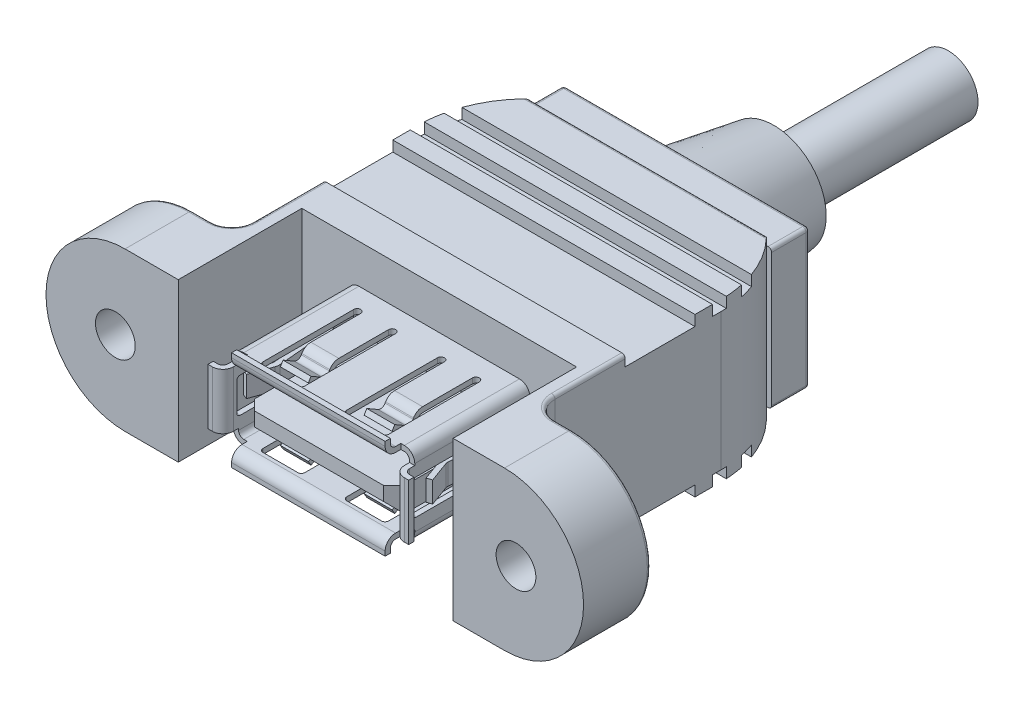
from build123d import *

# Parameters (mm, degrees)
EXTRUDE1_DEPTH     = 5.7531
SKETCH2_W          = 17.907
SKETCH2_H          = 10.16
EXTRUDE2_DEPTH     = 2.7686
EXTRUDE3_DEPTH     = 4.9
EXTRUDE4_DEPTH     = 1.27
SKETCH5_R          = 1.4478
CUT_EXTRUDE1_DEPTH = 4.9
SKETCH9_R          = 2.159
EXTRUDE5_DEPTH     = 12.7
CUT_EXTRUDE2_DEPTH = 0.762
CUT_EXTRUDE3_DEPTH = 0.762
FILLET1_R          = 1.524
FILLET2_R          = 0.254
EXTRUDE6_DEPTH     = 8.382
SKETCH11_W         = 0.381
SKETCH11_H         = 4.064
SKETCH11_W_2       = 11.176
SKETCH11_H_2       = 0.381
EXTRUDE7_DEPTH     = 0.254
EXTRUDE8_DEPTH     = 11.176
EXTRUDE9_DEPTH     = 4.064
CUT_EXTRUDE4_REACH = 44.824
CUT_EXTRUDE5_DEPTH = 13.462
EXTRUDE10_DEPTH    = 2.032
EXTRUDE11_DEPTH    = 2.032
EXTRUDE12_DEPTH    = 1.524
SKETCH21_W         = 10.922
SKETCH21_H         = 1.778
EXTRUDE14_DEPTH    = 8.7376
CHAMFER2_SIZE      = 0.762


with BuildPart() as part:
    # Sketch1 → Extrude1 (new, symmetric)
    with BuildSketch(Plane(origin=(0, 0, 0), x_dir=(1, 0, 0), z_dir=(0, 1, 0))):
        with BuildLine():
            Line((-10.00125, 0), (-10.00125, -8.9916))
            Line((-10.00125, -8.9916), (-10.9982, -8.9916))
            Line((-10.9982, -8.9916), (-10.9982, 9.525))
            ThreePointArc((-10.9982, 9.525), (-10.365731932, 12.629901726), (-8.569119124, 15.24))
            Line((-8.569119124, 15.24), (8.569119124, 15.24))
            ThreePointArc((8.569119124, 15.24), (10.365731932, 12.629901726), (10.9982, 9.525))
            Line((10.9982, 9.525), (10.9982, -8.9916))
            Line((10.9982, -8.9916), (10.00125, -8.9916))
            Line((10.00125, -8.9916), (10.00125, 0))
            Line((10.00125, 0), (-10.00125, 0))
        make_face()
    extrude(amount=EXTRUDE1_DEPTH, both=True)

    # Sketch2 → Extrude2 (add)
    with BuildSketch(Plane(origin=(0, 0, -15.24), x_dir=(-1, 0, 0), z_dir=(0, 0, -1))):
        Rectangle(SKETCH2_W, SKETCH2_H)
    extrude(amount=EXTRUDE2_DEPTH)

    # Sketch3 → Extrude3 (add)
    with BuildSketch(Plane.XY.offset(8.9916)):
        with BuildLine():
            Line((10.00125, 5.7531), (13.74575, 5.7531))
            ThreePointArc((13.74575, 5.7531), (19.49885, 0), (13.74575, -5.7531))
            Line((13.74575, -5.7531), (10.00125, -5.7531))
            Line((10.00125, -5.7531), (10.00125, 5.7531))
        make_face()
        with BuildLine():
            Line((-10.00125, 5.7531), (-13.87575, 5.7531))
            ThreePointArc((-13.87575, 5.7531), (-19.62885, 0), (-13.87575, -5.7531))
            Line((-13.87575, -5.7531), (-10.00125, -5.7531))
            Line((-10.00125, -5.7531), (-10.00125, 5.7531))
        make_face()
    extrude(amount=-EXTRUDE3_DEPTH)

    # Sketch4 → Extrude4 (add, symmetric)
    with BuildSketch(Plane(origin=(0, 0, 0), x_dir=(1, 0, 0), z_dir=(0, 1, 0))):
        Polygon((-10.9982, -1.5516), (-12.7762, -4.0916), (-10.9982, -4.0916), align=None)
        Polygon((10.9982, -1.5516), (12.7762, -4.0916), (10.9982, -4.0916), align=None)
    extrude(amount=EXTRUDE4_DEPTH, both=True)

    # Sketch5 → Cut-Extrude1 (cut)
    with BuildSketch(Plane.XY.offset(8.9916)):
        with Locations((-14.5801, 0)):
            Circle(SKETCH5_R)
        with Locations((14.5801, 0)):
            Circle(SKETCH5_R)
    extrude(amount=-CUT_EXTRUDE1_DEPTH, mode=Mode.SUBTRACT)

    # Sketch6 → Revolve1 (revolve)
    with BuildSketch(Plane(origin=(0, 0, 0), x_dir=(1, 0, 0), z_dir=(0, 1, 0)), mode=Mode.PRIVATE) as revolve1_sk:
        Polygon((0, 18.0086), (4.826, 18.0086), (3.81, 24.3586), (0, 24.3586), align=None)
    revolve(revolve1_sk.sketch.rotate(Axis((0, 0, -27.379986608), (0, 0, 1)), 180), axis=Axis((0, 0, -27.379986608), (0, 0, 1)))

    # Sketch9 → Extrude5 (add)
    with BuildSketch(Plane(origin=(0, 0, -24.3586), x_dir=(-1, 0, 0), z_dir=(0, 0, -1))):
        with Locations(Location((0, 0, 0), (0, 0, 180))):
            Circle(SKETCH9_R)
    extrude(amount=EXTRUDE5_DEPTH)

    # Sketch7 → Cut-Extrude2 (cut)
    with BuildSketch(Plane.XZ.offset(5.7531)):
        with BuildLine():
            Line((17.272, -2.54), (-17.272, -2.54))
            ThreePointArc((-17.272, -2.54), (-17.631210245, -2.688789755), (-17.78, -3.048))
            Line((-17.78, -3.048), (-17.78, -7.112))
            ThreePointArc((-17.78, -7.112), (-17.631210245, -7.471210245), (-17.272, -7.62))
            Line((-17.272, -7.62), (17.272, -7.62))
            ThreePointArc((17.272, -7.62), (17.631210245, -7.471210245), (17.78, -7.112))
            Line((17.78, -7.112), (17.78, -3.048))
            ThreePointArc((17.78, -3.048), (17.631210245, -2.688789755), (17.272, -2.54))
        make_face()
        with BuildLine():
            Line((17.272, -8.89), (-17.272, -8.89))
            ThreePointArc((-17.272, -8.89), (-17.78, -9.398), (-17.272, -9.906))
            Line((-17.272, -9.906), (17.272, -9.906))
            ThreePointArc((17.272, -9.906), (17.78, -9.398), (17.272, -8.89))
        make_face()
        with BuildLine():
            Line((16.256, -11.176), (-16.256, -11.176))
            ThreePointArc((-16.256, -11.176), (-16.764, -11.684), (-16.256, -12.192))
            Line((-16.256, -12.192), (16.256, -12.192))
            ThreePointArc((16.256, -12.192), (16.764, -11.684), (16.256, -11.176))
        make_face()
    extrude(amount=-CUT_EXTRUDE2_DEPTH, mode=Mode.SUBTRACT)

    # Sketch8 → Cut-Extrude3 (cut)
    with BuildSketch(Plane(origin=(0, 5.7531, 0), x_dir=(-1, 0, 0), z_dir=(0, 1, 0))):
        with BuildLine():
            Line((16.256, -11.176), (-16.256, -11.176))
            ThreePointArc((-16.256, -11.176), (-16.764, -11.684), (-16.256, -12.192))
            Line((-16.256, -12.192), (16.256, -12.192))
            ThreePointArc((16.256, -12.192), (16.764, -11.684), (16.256, -11.176))
        make_face()
        with BuildLine():
            Line((17.272, -8.89), (-17.272, -8.89))
            ThreePointArc((-17.272, -8.89), (-17.78, -9.398), (-17.272, -9.906))
            Line((-17.272, -9.906), (17.272, -9.906))
            ThreePointArc((17.272, -9.906), (17.78, -9.398), (17.272, -8.89))
        make_face()
        with BuildLine():
            Line((17.272, -2.54), (-17.272, -2.54))
            ThreePointArc((-17.272, -2.54), (-17.631210245, -2.688789755), (-17.78, -3.048))
            Line((-17.78, -3.048), (-17.78, -7.112))
            ThreePointArc((-17.78, -7.112), (-17.631210245, -7.471210245), (-17.272, -7.62))
            Line((-17.272, -7.62), (17.272, -7.62))
            ThreePointArc((17.272, -7.62), (17.631210245, -7.471210245), (17.78, -7.112))
            Line((17.78, -7.112), (17.78, -3.048))
            ThreePointArc((17.78, -3.048), (17.631210245, -2.688789755), (17.272, -2.54))
        make_face()
    extrude(amount=-CUT_EXTRUDE3_DEPTH, mode=Mode.SUBTRACT)

    # Fillet1
    fillet1_edges = [part.edges().sort_by_distance(p)[0] for p in [
        (10.9982, 3.51155, 4.0916),
        (-10.9982, 3.51155, 4.0916),
        (-10.9982, -3.51155, 4.0916),
        (10.9982, -3.51155, 4.0916),
    ]]
    fillet(fillet1_edges, radius=FILLET1_R)

    # Fillet2
    fillet2_edges = [part.edges().sort_by_distance(p)[0] for p in [
        (10.9982, 5.7531, 0.0138),
        (10.9982, -5.7531, 0.0138),
        (-10.9982, 5.7531, 0.0138),
        (-11.444569265, 5.7531, 3.645230735),
        (-13.198975, 5.7531, 4.0916),
        (11.444569265, 5.7531, 3.645230735),
        (13.133975, 5.7531, 4.0916),
        (11.444569265, -5.7531, 3.645230735),
        (-10.9982, -5.7531, 0.0138),
        (-11.444569265, -5.7531, 3.645230735),
        (-13.198975, -5.7531, 4.0916),
        (13.133975, -5.7531, 4.0916),
        (8.569119124, 5.41655, -15.24),
        (-19.62885, 0, 4.0916),
        (19.49885, 0, 4.0916),
        (-8.569119124, 5.41655, -15.24),
        (0, -5.7531, -15.24),
        (0, 5.7531, -15.24),
        (-8.9535, -5.08, -16.6243),
        (8.9535, -5.08, -16.6243),
        (0, -5.08, -18.0086),
        (8.9535, 5.08, -16.6243),
        (8.9535, 0, -18.0086),
        (-8.9535, 5.08, -16.6243),
        (0, 5.08, -18.0086),
        (-8.9535, 0, -18.0086),
    ]]
    fillet(fillet2_edges, radius=FILLET2_R)

    # Sketch10 → Extrude6 (add)
    with BuildSketch(Plane.XY):
        with BuildLine():
            Line((-5.842, 2.921), (5.842, 2.921))
            ThreePointArc((5.842, 2.921), (6.380815367, 2.697815367), (6.604, 2.159))
            Line((6.604, 2.159), (6.604, -2.159))
            ThreePointArc((6.604, -2.159), (6.380815367, -2.697815367), (5.842, -2.921))
            Line((5.842, -2.921), (-5.842, -2.921))
            ThreePointArc((-5.842, -2.921), (-6.380815367, -2.697815367), (-6.604, -2.159))
            Line((-6.604, -2.159), (-6.604, 2.159))
            ThreePointArc((-6.604, 2.159), (-6.380815367, 2.697815367), (-5.842, 2.921))
        make_face()
        with BuildLine():
            Line((-5.842, 2.54), (5.842, 2.54))
            ThreePointArc((5.842, 2.54), (6.111407684, 2.428407684), (6.223, 2.159))
            Line((6.223, 2.159), (6.223, -2.159))
            ThreePointArc((6.223, -2.159), (6.111407684, -2.428407684), (5.842, -2.54))
            Line((5.842, -2.54), (-5.842, -2.54))
            ThreePointArc((-5.842, -2.54), (-6.111407684, -2.428407684), (-6.223, -2.159))
            Line((-6.223, -2.159), (-6.223, 2.159))
            ThreePointArc((-6.223, 2.159), (-6.111407684, 2.428407684), (-5.842, 2.54))
        make_face(mode=Mode.SUBTRACT)
    extrude(amount=EXTRUDE6_DEPTH)

    # Sketch11 → Extrude7 (add)
    with BuildSketch(Plane.XY.offset(8.382)):
        with Locations((-6.4135, 0)):
            Rectangle(SKETCH11_W, SKETCH11_H)
        with Locations((0, -2.7305)):
            Rectangle(SKETCH11_W_2, SKETCH11_H_2)
        with Locations((0, 2.7305)):
            Rectangle(SKETCH11_W_2, SKETCH11_H_2)
        with Locations((6.4135, 0)):
            Rectangle(SKETCH11_W, SKETCH11_H)
    extrude(amount=EXTRUDE7_DEPTH)

    # Sketch12 → Extrude8 (add)
    with BuildSketch(Plane(origin=(5.588, 0, 0), x_dir=(0, 0, -1), z_dir=(1, 0, 0))):
        with BuildLine():
            Line((-9.525, 3.302), (-9.525, 3.6195))
            Line((-9.525, 3.6195), (-9.144, 3.6195))
            Line((-9.144, 3.6195), (-9.144, 3.302))
            ThreePointArc((-9.144, 3.302), (-9.032407684, 3.032592316), (-8.763, 2.921))
            Line((-8.763, 2.921), (-8.382, 2.921))
            Line((-8.382, 2.921), (-8.382, 2.54))
            Line((-8.382, 2.54), (-8.763, 2.54))
            ThreePointArc((-8.763, 2.54), (-9.301815367, 2.763184633), (-9.525, 3.302))
        make_face()
        with BuildLine():
            Line((-9.525, -3.302), (-9.525, -3.6195))
            Line((-9.525, -3.6195), (-9.144, -3.6195))
            Line((-9.144, -3.6195), (-9.144, -3.302))
            ThreePointArc((-9.144, -3.302), (-9.032407684, -3.032592316), (-8.763, -2.921))
            Line((-8.763, -2.921), (-8.382, -2.921))
            Line((-8.382, -2.921), (-8.382, -2.54))
            Line((-8.382, -2.54), (-8.763, -2.54))
            ThreePointArc((-8.763, -2.54), (-9.301815367, -2.763184633), (-9.525, -3.302))
        make_face()
    extrude(amount=-EXTRUDE8_DEPTH)

    # Sketch13 → Extrude9 (add)
    with BuildSketch(Plane(origin=(0, 2.032, 0), x_dir=(-1, 0, 0), z_dir=(0, 1, 0))):
        with BuildLine():
            Line((-6.985, 9.144), (-7.3025, 9.144))
            Line((-7.3025, 9.144), (-7.3025, 9.525))
            Line((-7.3025, 9.525), (-6.985, 9.525))
            ThreePointArc((-6.985, 9.525), (-6.446184633, 9.301815367), (-6.223, 8.763))
            Line((-6.223, 8.763), (-6.223, 8.382))
            Line((-6.223, 8.382), (-6.604, 8.382))
            Line((-6.604, 8.382), (-6.604, 8.763))
            ThreePointArc((-6.604, 8.763), (-6.715592316, 9.032407684), (-6.985, 9.144))
        make_face()
        with BuildLine():
            Line((6.985, 9.144), (7.3025, 9.144))
            Line((7.3025, 9.144), (7.3025, 9.525))
            Line((7.3025, 9.525), (6.985, 9.525))
            ThreePointArc((6.985, 9.525), (6.446184633, 9.301815367), (6.223, 8.763))
            Line((6.223, 8.763), (6.223, 8.382))
            Line((6.223, 8.382), (6.604, 8.382))
            Line((6.604, 8.382), (6.604, 8.763))
            ThreePointArc((6.604, 8.763), (6.715592316, 9.032407684), (6.985, 9.144))
        make_face()
    extrude(amount=-EXTRUDE9_DEPTH)

    # Cut-Extrude4: up to this face of the body (flat: up to its plane)
    cut_extrude4_end = Plane(part.part.faces().sort_by_distance((0, -2.921, 4.3735625))[0])
    # Sketch14 → Cut-Extrude4 (cut, up to the picked face)
    with BuildSketch(Plane(origin=(0, 2.921, 0), x_dir=(-1, 0, 0), z_dir=(0, 1, 0)), mode=Mode.PRIVATE) as cut_extrude4_sk1:
        with BuildLine():
            Line((-2.032, 1.651), (-2.032, 2.159))
            Line((-2.032, 2.159), (-4.064, 2.159))
            Line((-4.064, 2.159), (-4.064, 1.651))
            ThreePointArc((-4.064, 1.651), (-4.318, 1.397), (-4.572, 1.651))
            Line((-4.572, 1.651), (-4.572, 8.255))
            ThreePointArc((-4.572, 8.255), (-4.497605122, 8.434605122), (-4.318, 8.509))
            Line((-4.318, 8.509), (-1.778, 8.509))
            ThreePointArc((-1.778, 8.509), (-1.598394878, 8.434605122), (-1.524, 8.255))
            Line((-1.524, 8.255), (-1.524, 1.651))
            ThreePointArc((-1.524, 1.651), (-1.778, 1.397), (-2.032, 1.651))
        make_face()
    cut_extrude4_tool1 = split(extrude(cut_extrude4_sk1.sketch, amount=-CUT_EXTRUDE4_REACH, mode=Mode.PRIVATE), bisect_by=cut_extrude4_end, keep=Keep.BOTH, mode=Mode.PRIVATE)
    # Sketch14 → Cut-Extrude4 (cut, up to the picked face)
    with BuildSketch(Plane(origin=(0, 2.921, 0), x_dir=(-1, 0, 0), z_dir=(0, 1, 0)), mode=Mode.PRIVATE) as cut_extrude4_sk2:
        with BuildLine():
            Line((4.572, 1.651), (4.572, 8.255))
            ThreePointArc((4.572, 8.255), (4.497605122, 8.434605122), (4.318, 8.509))
            Line((4.318, 8.509), (1.778, 8.509))
            ThreePointArc((1.778, 8.509), (1.598394878, 8.434605122), (1.524, 8.255))
            Line((1.524, 8.255), (1.524, 1.651))
            ThreePointArc((1.524, 1.651), (1.778, 1.397), (2.032, 1.651))
            Line((2.032, 1.651), (2.032, 2.159))
            Line((2.032, 2.159), (4.064, 2.159))
            Line((4.064, 2.159), (4.064, 1.651))
            ThreePointArc((4.064, 1.651), (4.318, 1.397), (4.572, 1.651))
        make_face()
    cut_extrude4_tool2 = split(extrude(cut_extrude4_sk2.sketch, amount=-CUT_EXTRUDE4_REACH, mode=Mode.PRIVATE), bisect_by=cut_extrude4_end, keep=Keep.BOTH, mode=Mode.PRIVATE)
    add(cut_extrude4_tool1.solids().sort_by(Axis((3.048, 2.921, 5.203077), (0, -1, 0)))[0], mode=Mode.SUBTRACT)
    add(cut_extrude4_tool2.solids().sort_by(Axis((-3.048, 2.921, 5.203077), (0, -1, 0)))[0], mode=Mode.SUBTRACT)

    # Sketch15 → Cut-Extrude5 (cut)
    with BuildSketch(Plane(origin=(6.604, 0, 0), x_dir=(0, 0, -1), z_dir=(1, 0, 0))):
        with BuildLine():
            Line((-8.255, 1.27), (-1.651, 1.27))
            ThreePointArc((-1.651, 1.27), (-1.397, 1.016), (-1.651, 0.762))
            Line((-1.651, 0.762), (-1.905, 0.762))
            Line((-1.905, 0.762), (-1.905, -0.762))
            Line((-1.905, -0.762), (-1.651, -0.762))
            ThreePointArc((-1.651, -0.762), (-1.397, -1.016), (-1.651, -1.27))
            Line((-1.651, -1.27), (-8.255, -1.27))
            ThreePointArc((-8.255, -1.27), (-8.434605122, -1.195605122), (-8.509, -1.016))
            Line((-8.509, -1.016), (-8.509, 1.016))
            ThreePointArc((-8.509, 1.016), (-8.434605122, 1.195605122), (-8.255, 1.27))
        make_face()
    extrude(amount=-CUT_EXTRUDE5_DEPTH, mode=Mode.SUBTRACT)

    # Sketch17 → Extrude10 (add)
    with BuildSketch(Plane(origin=(4.064, 0, 0), x_dir=(0, 0, -1), z_dir=(1, 0, 0))):
        with BuildLine():
            Line((-5.934970453, 2.54), (-5.971632195, 2.4765))
            ThreePointArc((-5.971632195, 2.4765), (-6.202977817, 2.29898226), (-6.492087873, 2.337044321))
            Line((-6.492087873, 2.337044321), (-7.3025, 2.804935981))
            Line((-7.3025, 2.804935981), (-7.493, 2.474980302))
            Line((-7.493, 2.474980302), (-6.682587873, 2.007088642))
            ThreePointArc((-6.682587873, 2.007088642), (-6.104367761, 1.93096452), (-5.641676516, 2.286))
            Line((-5.641676516, 2.286), (-5.605014774, 2.3495))
            ThreePointArc((-5.605014774, 2.3495), (-5.465559095, 2.488955679), (-5.275059095, 2.54))
            Line((-5.275059095, 2.54), (-1.651, 2.54))
            Line((-1.651, 2.54), (-1.651, 2.921))
            Line((-1.651, 2.921), (-5.275059095, 2.921))
            ThreePointArc((-5.275059095, 2.921), (-5.656059095, 2.818911358), (-5.934970453, 2.54))
        make_face()
        with BuildLine():
            Line((-5.641676516, -2.286), (-5.605014774, -2.3495))
            ThreePointArc((-5.605014774, -2.3495), (-5.465559095, -2.488955679), (-5.275059095, -2.54))
            Line((-5.275059095, -2.54), (-1.651, -2.54))
            Line((-1.651, -2.54), (-1.651, -2.921))
            Line((-1.651, -2.921), (-5.275059095, -2.921))
            ThreePointArc((-5.275059095, -2.921), (-5.656059095, -2.818911358), (-5.934970453, -2.54))
            Line((-5.934970453, -2.54), (-5.971632195, -2.4765))
            ThreePointArc((-5.971632195, -2.4765), (-6.202977817, -2.29898226), (-6.492087873, -2.337044321))
            Line((-6.492087873, -2.337044321), (-7.3025, -2.804935981))
            Line((-7.3025, -2.804935981), (-7.493, -2.474980302))
            Line((-7.493, -2.474980302), (-6.682587873, -2.007088642))
            ThreePointArc((-6.682587873, -2.007088642), (-6.104367761, -1.93096452), (-5.641676516, -2.286))
        make_face()
    extrude(amount=-EXTRUDE10_DEPTH)

    # Sketch18 → Extrude11 (add)
    with BuildSketch(Plane(origin=(-2.032, 0, 0), x_dir=(0, 0, -1), z_dir=(1, 0, 0))):
        with BuildLine():
            Line((-5.934970453, 2.54), (-5.971632195, 2.4765))
            ThreePointArc((-5.971632195, 2.4765), (-6.202977817, 2.29898226), (-6.492087873, 2.337044321))
            Line((-6.492087873, 2.337044321), (-7.3025, 2.804935981))
            Line((-7.3025, 2.804935981), (-7.493, 2.474980302))
            Line((-7.493, 2.474980302), (-6.682587873, 2.007088642))
            ThreePointArc((-6.682587873, 2.007088642), (-6.104367761, 1.93096452), (-5.641676516, 2.286))
            Line((-5.641676516, 2.286), (-5.605014774, 2.3495))
            ThreePointArc((-5.605014774, 2.3495), (-5.465559095, 2.488955679), (-5.275059095, 2.54))
            Line((-5.275059095, 2.54), (-1.651, 2.54))
            Line((-1.651, 2.54), (-1.651, 2.921))
            Line((-1.651, 2.921), (-5.275059095, 2.921))
            ThreePointArc((-5.275059095, 2.921), (-5.656059095, 2.818911358), (-5.934970453, 2.54))
        make_face()
        with BuildLine():
            Line((-5.605014774, -2.3495), (-5.641676516, -2.286))
            ThreePointArc((-5.641676516, -2.286), (-6.104367761, -1.93096452), (-6.682587873, -2.007088642))
            Line((-6.682587873, -2.007088642), (-7.493, -2.474980302))
            Line((-7.493, -2.474980302), (-7.3025, -2.804935981))
            Line((-7.3025, -2.804935981), (-6.492087873, -2.337044321))
            ThreePointArc((-6.492087873, -2.337044321), (-6.202977817, -2.29898226), (-5.971632195, -2.4765))
            Line((-5.971632195, -2.4765), (-5.934970453, -2.54))
            ThreePointArc((-5.934970453, -2.54), (-5.656059095, -2.818911358), (-5.275059095, -2.921))
            Line((-5.275059095, -2.921), (-1.651, -2.921))
            Line((-1.651, -2.921), (-1.651, -2.54))
            Line((-1.651, -2.54), (-5.275059095, -2.54))
            ThreePointArc((-5.275059095, -2.54), (-5.465559095, -2.488955679), (-5.605014774, -2.3495))
        make_face()
    extrude(amount=-EXTRUDE11_DEPTH)

    # Sketch20 → Extrude12 (add)
    with BuildSketch(Plane(origin=(0, 0.762, 0), x_dir=(-1, 0, 0), z_dir=(0, 1, 0))):
        with BuildLine():
            Line((-6.60110036, 2.446143037), (-6.318017611, 5.681793662))
            ThreePointArc((-6.318017611, 5.681793662), (-6.319827299, 5.764730479), (-6.339544903, 5.845309675))
            Line((-6.339544903, 5.845309675), (-6.891826294, 7.362690325))
            Line((-6.891826294, 7.362690325), (-6.533803405, 7.493))
            Line((-6.533803405, 7.493), (-5.981522014, 5.975619349))
            ThreePointArc((-5.981522014, 5.975619349), (-5.942086807, 5.814460958), (-5.938467431, 5.648587324))
            Line((-5.938467431, 5.648587324), (-6.223, 2.396365181))
            Line((-6.223, 2.396365181), (-6.223, 1.651))
            Line((-6.223, 1.651), (-6.604, 1.651))
            Line((-6.604, 1.651), (-6.604, 2.379730362))
            ThreePointArc((-6.604, 2.379730362), (-6.603274745, 2.412968335), (-6.60110036, 2.446143037))
        make_face()
        with BuildLine():
            Line((6.60110036, 2.446143037), (6.318017611, 5.681793662))
            ThreePointArc((6.318017611, 5.681793662), (6.319827299, 5.764730479), (6.339544903, 5.845309675))
            Line((6.339544903, 5.845309675), (6.891826294, 7.362690325))
            Line((6.891826294, 7.362690325), (6.533803405, 7.493))
            Line((6.533803405, 7.493), (5.981522014, 5.975619349))
            ThreePointArc((5.981522014, 5.975619349), (5.942086807, 5.814460958), (5.938467431, 5.648587324))
            Line((5.938467431, 5.648587324), (6.223, 2.396365181))
            Line((6.223, 2.396365181), (6.223, 1.651))
            Line((6.223, 1.651), (6.604, 1.651))
            Line((6.604, 1.651), (6.604, 2.379730362))
            ThreePointArc((6.604, 2.379730362), (6.603274745, 2.412968335), (6.60110036, 2.446143037))
        make_face()
    extrude(amount=-EXTRUDE12_DEPTH)

    # Sketch21 → Extrude14 (add)
    with BuildSketch(Plane.XY):
        with Locations((0, -0.889)):
            Rectangle(SKETCH21_W, SKETCH21_H)
    extrude(amount=EXTRUDE14_DEPTH)

    # Chamfer2
    chamfer2_edges = [part.edges().sort_by_distance(p)[0] for p in [
        (-5.461, -0.889, 8.7376),
        (0, -1.778, 8.7376),
        (5.461, -0.889, 8.7376),
    ]]
    chamfer(chamfer2_edges, length=CHAMFER2_SIZE)


solid = part.part
